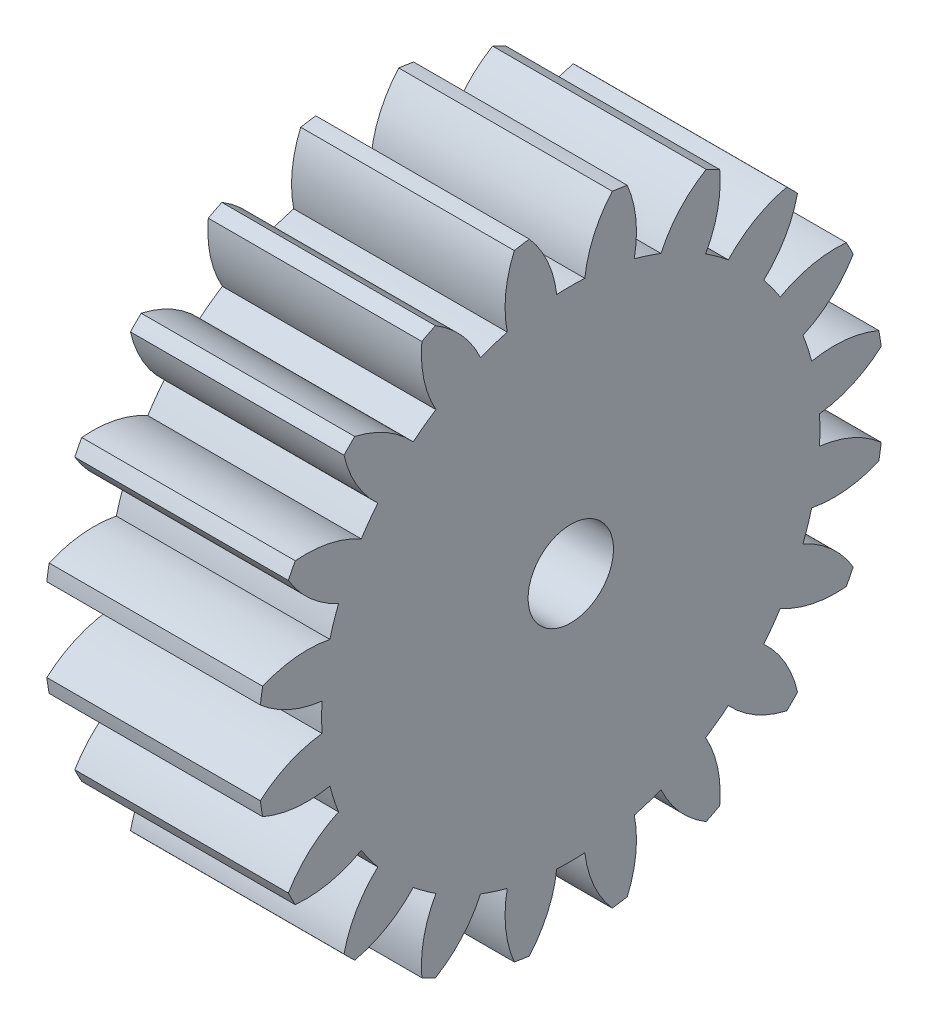
from build123d import *

# Parameters (mm, degrees)
BASPROSKE_W     = 15
BASPROSKE_H     = 22
TOOTHCUT_DEPTH  = 35.539832078
TEETHCUTS_COUNT = 20
TEETHCUTS_ANGLE = 342
BORSKE_R        = 3
BORE_DEPTH      = 50.0000508


with BuildPart() as part:
    # BasProSke → Base-Revolve (revolve)
    with BuildSketch(Plane(origin=(0, 0, 0), x_dir=(1, 0, 0), z_dir=(0, 1, 0)), mode=Mode.PRIVATE) as base_revolve_sk:
        with Locations((7.5, 11)):
            Rectangle(BASPROSKE_W, BASPROSKE_H)
    revolve(base_revolve_sk.sketch.rotate(Axis((-10, 0, 0), (1, 0, 0)), 180), axis=Axis((-10, 0, 0), (1, 0, 0)))

    # TooCutSke → ToothCut (cut, through all)
    with BuildSketch(Plane(origin=(0, 0, 0), x_dir=(0, 0, -1), z_dir=(1, 0, 0))):
        with BuildLine():
            ThreePointArc((0.986171591, 17.471189616), (0, 17.499), (-0.986171591, 17.471189616))
            ThreePointArc((-0.986171591, 17.471189616), (-1.626916196, 19.798789858), (-2.932850173, 21.829260982))
            ThreePointArc((-2.932850173, 21.829260982), (0, 22.0254), (2.932850173, 21.829260982))
            ThreePointArc((2.932850173, 21.829260982), (1.626916196, 19.798789858), (0.986171591, 17.471189616))
        make_face()
    toothcut = extrude(amount=TOOTHCUT_DEPTH, mode=Mode.SUBTRACT)

    # TeethCuts: ToothCut ×20 about axis
    teethcuts_axis = Axis((-10, 0, 0), (1, 0, 0))
    for i in range(1, TEETHCUTS_COUNT):
        add(toothcut.rotate(teethcuts_axis, i * TEETHCUTS_ANGLE / (TEETHCUTS_COUNT - 1)), mode=Mode.SUBTRACT)

    # BorSke → Bore (cut, symmetric)
    with BuildSketch(Plane(origin=(0, 0, 0), x_dir=(0, 0, -1), z_dir=(1, 0, 0))):
        with Locations(Location((0, 0, 0), (0, 0, 180))):
            Circle(BORSKE_R)
    extrude(amount=BORE_DEPTH, both=True, mode=Mode.SUBTRACT)


solid = part.part
